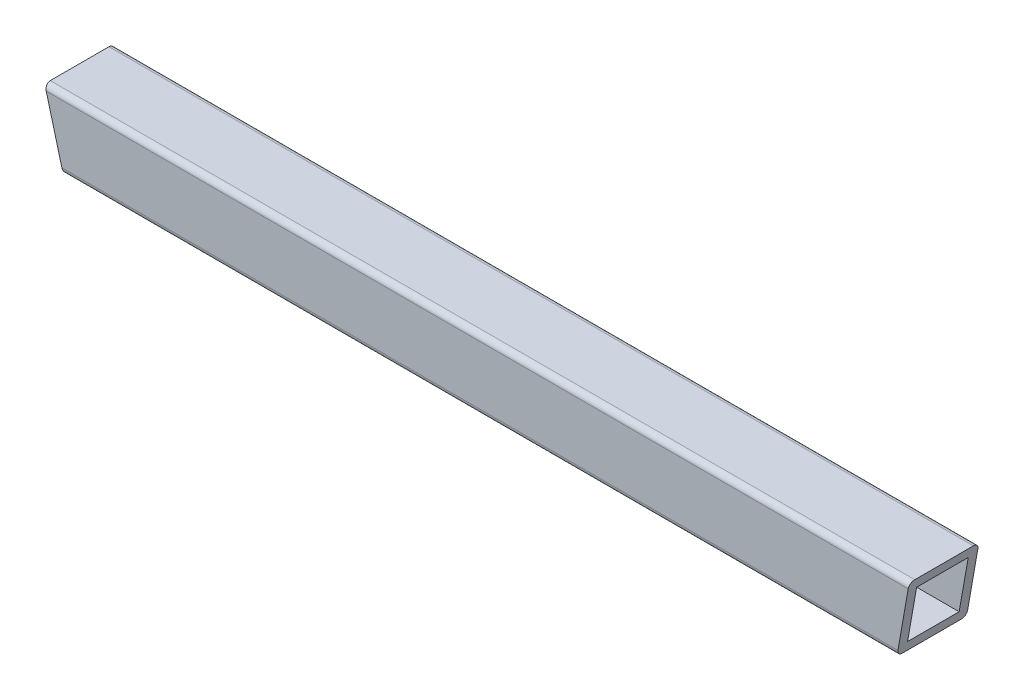
from build123d import *

# Parameters (mm, degrees)
SKETCH1_W           = 23.495
SKETCH1_H           = 23.495
BOSS_EXTRUDE1_DEPTH = 393.7
SCALE1_SCALE_X      = 1
SCALE1_SCALE_Y      = 0.4
SCALE1_SCALE_Z      = 0.4
CUT_EXTRUDE3_DEPTH  = 395.531279762


with BuildPart() as part:
    # Sketch1 → Boss-Extrude1 (new body)
    with BuildSketch(Plane(origin=(0, 0, 0), x_dir=(0, 0, -1), z_dir=(1, 0, 0))):
        with BuildLine():
            Line((0, 2.54), (0, 29.21))
            ThreePointArc((0, 29.21), (-0.743948776, 31.006051224), (-2.54, 31.75))
            Line((-2.54, 31.75), (-29.21, 31.75))
            ThreePointArc((-29.21, 31.75), (-31.006051224, 31.006051224), (-31.75, 29.21))
            Line((-31.75, 29.21), (-31.75, 2.54))
            ThreePointArc((-31.75, 2.54), (-31.006051224, 0.743948776), (-29.21, 0))
            Line((-29.21, 0), (-2.54, 0))
            ThreePointArc((-2.54, 0), (-0.743948776, 0.743948776), (0, 2.54))
        make_face()
        with Locations((-15.875, 15.875)):
            Rectangle(SKETCH1_W, SKETCH1_H, mode=Mode.SUBTRACT)
    extrude(amount=BOSS_EXTRUDE1_DEPTH)


with BuildPart() as part_1:
    # Scale1: scaled about (196.85, 15.875, 15.875)
    add(part.part.scale((SCALE1_SCALE_X, SCALE1_SCALE_Y, SCALE1_SCALE_Z), about=(196.85, 15.875, 15.875)))

    # Sketch5 → Cut-Extrude3 (cut, through all)
    with BuildSketch(Plane(origin=(0, 0, 9.525), x_dir=(-1, 0, 0), z_dir=(0, 0, -1))):
        Polygon((-195.500423074, 9.525), (-192.09746833, 22.225), (-165.127052911, 22.225), (-162.887700256, 9.525), align=None)
        Polygon((-11.018976282, 9.525), (0, 9.525), (0, 22.225), (-7.616021538, 22.225), align=None)
    extrude(amount=-CUT_EXTRUDE3_DEPTH, mode=Mode.SUBTRACT)


with BuildPart() as body_2:
    # of the pieces the cut leaves, the one that is kept (cut_extrude3_keep)
    add(part_1.part.solids().sort_by_distance((7.888257918, 21.209, 9.525))[0])


solid = body_2.part
